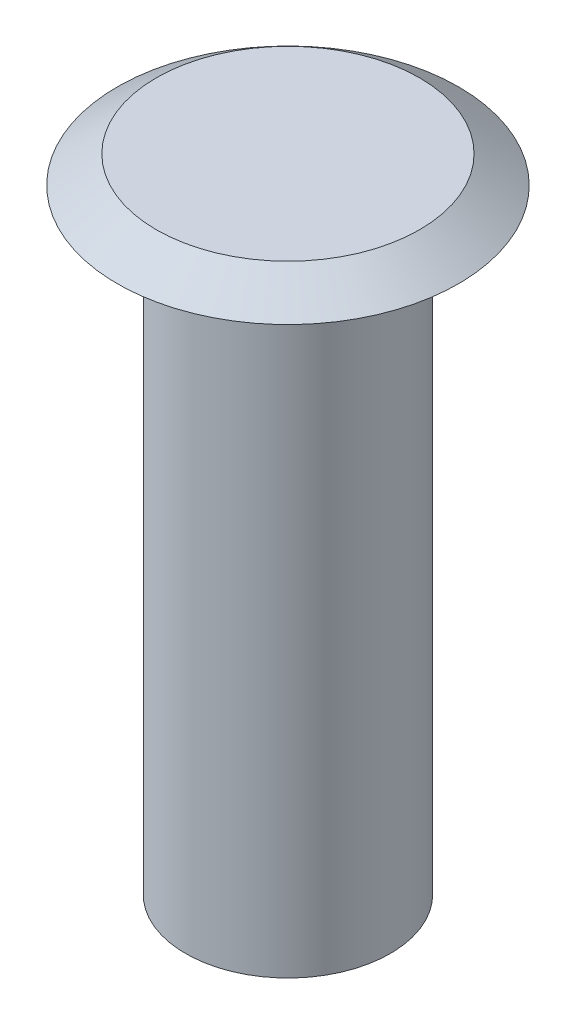
from build123d import *


with BuildPart() as part:
    # 草图1 → 旋转1 (revolve)
    with BuildSketch(Plane.XY, mode=Mode.PRIVATE) as revolve_1_sk:
        Polygon((0, 9.4), (-1.928740797, 9.4), (-2.5, 9), (-1.5, 9), (-1.5, 0), (-0.6, 0), (-0.6, 4), (0, 4), align=None)
    revolve(revolve_1_sk.sketch.rotate(Axis((0, 0, 0), (0, 1, 0)), 270), axis=Axis((0, 0, 0), (0, 1, 0)))


solid = part.part
